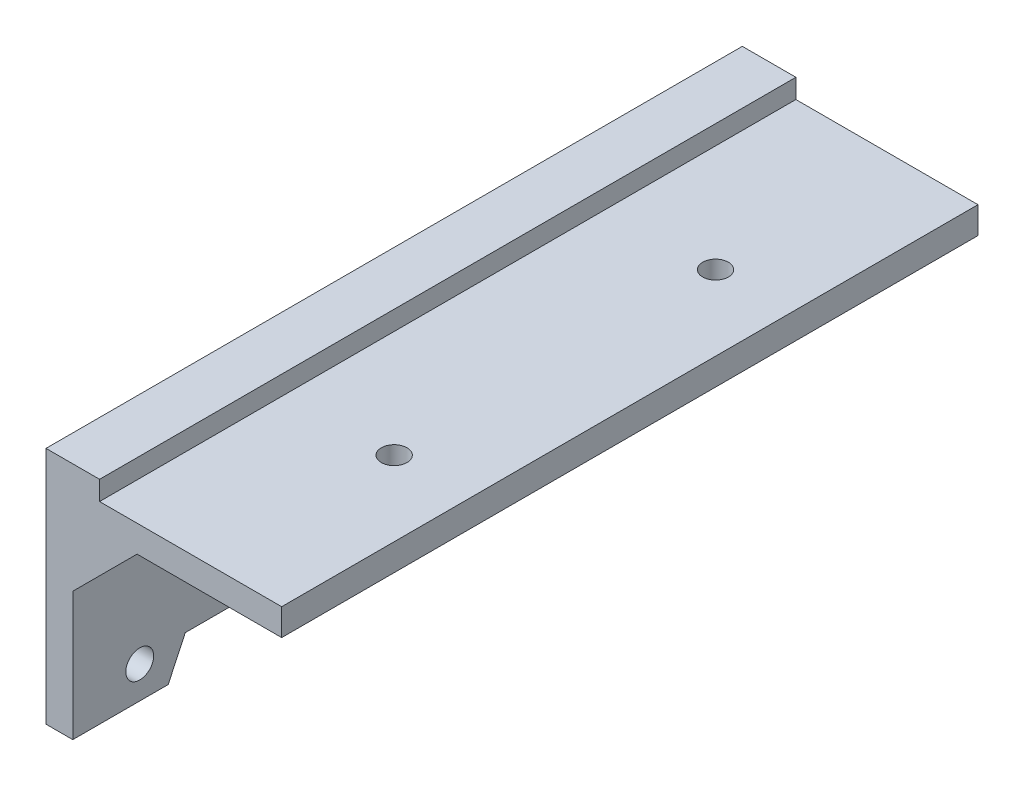
from build123d import *

# Parameters (mm, degrees)
SKETCH1_W           = 82.55
SKETCH1_H           = 26.67
BOSS_EXTRUDE1_DEPTH = 1.5875
SKETCH2_R           = 1.651
SKETCH2_R_2         = 1.5875
CUT_EXTRUDE1_DEPTH  = 3.175
SKETCH5_W           = 82.55
SKETCH5_H           = 3.175
BOSS_EXTRUDE3_DEPTH = 27.94
SKETCH6_R           = 1.524
CUT_EXTRUDE3_DEPTH  = 3.175
CUT_EXTRUDE4_DEPTH  = 3.175
BOSS_EXTRUDE4_DEPTH = 82.55
CUT_EXTRUDE5_DEPTH  = 3.175
SKETCH10_W          = 6.35
SKETCH10_H          = 82.55
BOSS_EXTRUDE5_DEPTH = 2.286


with BuildPart() as part:
    # Sketch1 → Boss-Extrude1 (new, symmetric)
    with BuildSketch(Plane(origin=(0, 0, 0), x_dir=(0, 0, -1), z_dir=(1, 0, 0))):
        Rectangle(SKETCH1_W, SKETCH1_H)
    extrude(amount=BOSS_EXTRUDE1_DEPTH, both=True)

    # Sketch2 → Cut-Extrude1 (cut)
    with BuildSketch(Plane.ZY.offset(1.5875)):
        with Locations((33.3375, -5.715)):
            Circle(SKETCH2_R)
        with Locations((-33.3375, -5.715)):
            Circle(SKETCH2_R)
        with Locations((-26.4795, -10.16)):
            Circle(SKETCH2_R_2)
        with Locations((26.4795, -10.16)):
            Circle(SKETCH2_R_2)
    extrude(amount=-CUT_EXTRUDE1_DEPTH, mode=Mode.SUBTRACT)

    # Sketch5 → Boss-Extrude3 (add)
    with BuildSketch(Plane.ZY.offset(1.5875)):
        with Locations((0, 14.9225)):
            Rectangle(SKETCH5_W, SKETCH5_H)
    extrude(amount=-BOSS_EXTRUDE3_DEPTH)

    # Sketch6 → Cut-Extrude3 (cut)
    with BuildSketch(Plane(origin=(0, 16.51, 0), x_dir=(1, 0, 0), z_dir=(0, 1, 0))):
        with Locations(Location((17.4625, 19.05, 0), (0, 0, 270))):
            Circle(SKETCH6_R)
        with Locations(Location((17.4625, -19.05, 0), (0, 0, 270))):
            Circle(SKETCH6_R)
    extrude(amount=-CUT_EXTRUDE3_DEPTH, mode=Mode.SUBTRACT)

    # Sketch7 → Cut-Extrude4 (cut)
    with BuildSketch(Plane.ZY.offset(1.5875)):
        Polygon((-31.75, -13.335), (31.75, -13.335), (27.94, -5.207), (-27.94, -5.207), align=None)
    extrude(amount=-CUT_EXTRUDE4_DEPTH, mode=Mode.SUBTRACT)

    # Sketch8 → Boss-Extrude4 (add)
    with BuildSketch(Plane.XY.offset(41.275)):
        Polygon((1.5875, 13.335), (9.2075, 13.335), (1.5875, 5.715), align=None)
    extrude(amount=-BOSS_EXTRUDE4_DEPTH)

    # Sketch9 → Cut-Extrude5 (cut)
    with BuildSketch(Plane.ZY.offset(1.5875)):
        Polygon((-41.275, -13.335), (-41.275, -9.525), (-29.9640625, -9.525), (-31.75, -13.335), align=None)
        Polygon((41.275, -13.335), (41.275, -9.525), (29.9640625, -9.525), (31.75, -13.335), align=None)
    extrude(amount=-CUT_EXTRUDE5_DEPTH, mode=Mode.SUBTRACT)

    # Sketch10 → Boss-Extrude5 (add)
    with BuildSketch(Plane(origin=(0, 16.51, 0), x_dir=(1, 0, 0), z_dir=(0, 1, 0))):
        with Locations((1.5875, 0)):
            Rectangle(SKETCH10_W, SKETCH10_H)
    extrude(amount=BOSS_EXTRUDE5_DEPTH)


solid = part.part
